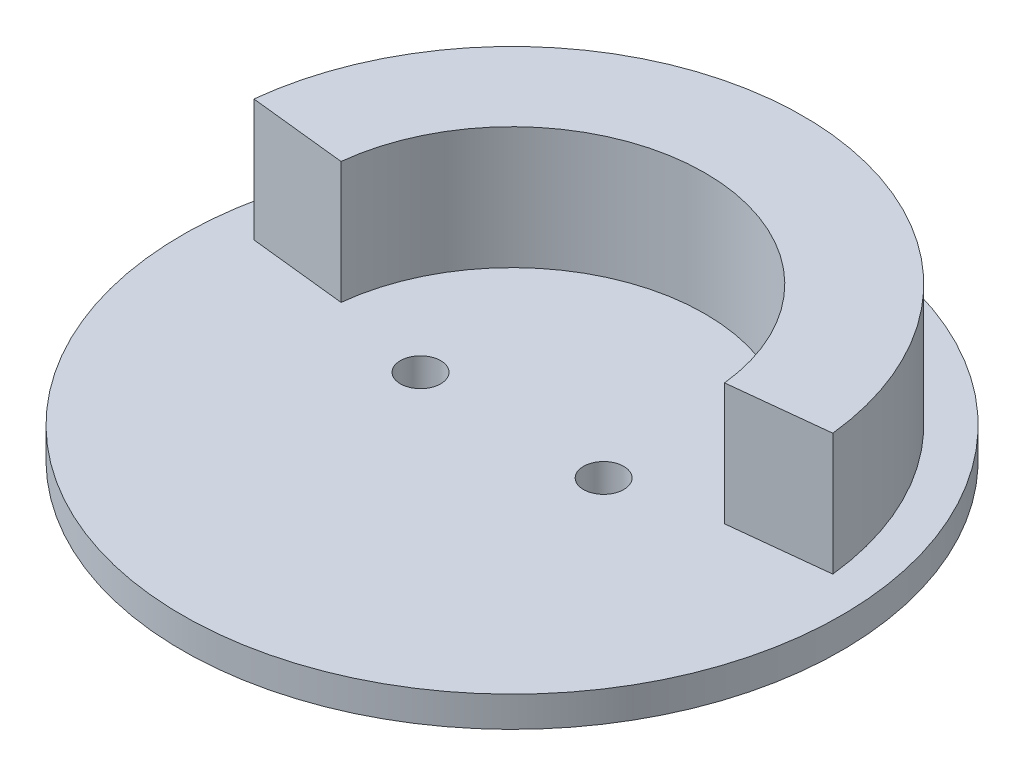
from build123d import *

# Parameters (mm, degrees)
BOSS_EXTRUDE1_DEPTH = 10
SKETCH2_R           = 27
BOSS_EXTRUDE2_DEPTH = 2.5
SKETCH3_R           = 1.65
CUT_EXTRUDE1_DEPTH  = 10


with BuildPart() as part:
    # Sketch1 → Boss-Extrude1 (new body)
    with BuildSketch(Plane(origin=(0, 0, 0), x_dir=(1, 0, 0), z_dir=(0, 1, 0))):
        with BuildLine():
            Line((-23.711759029, 2.564173113), (-15.708418979, 1.698697492))
            ThreePointArc((-15.708418979, 1.698697492), (0, 15.8), (15.708418979, 1.698697492))
            Line((15.708418979, 1.698697492), (23.711759029, 2.564173113))
            ThreePointArc((23.711759029, 2.564173113), (0, 23.85), (-23.711759029, 2.564173113))
        make_face()
    extrude(amount=BOSS_EXTRUDE1_DEPTH)

    # Sketch2 → Boss-Extrude2 (add)
    with BuildSketch(Plane.XZ):
        with Locations(Location((0, 0, 0), (0, 0, 270))):
            Circle(SKETCH2_R)
    extrude(amount=BOSS_EXTRUDE2_DEPTH)

    # Sketch3 → Cut-Extrude1 (cut)
    with BuildSketch(Plane(origin=(0, 0, 0), x_dir=(1, 0, 0), z_dir=(0, 1, 0))):
        with Locations(Location((-7.5, 0, 0), (0, 0, 270))):
            Circle(SKETCH3_R)
        with Locations(Location((7.5, 0, 0), (0, 0, 90))):
            Circle(SKETCH3_R)
    extrude(amount=-CUT_EXTRUDE1_DEPTH, mode=Mode.SUBTRACT)


solid = part.part
